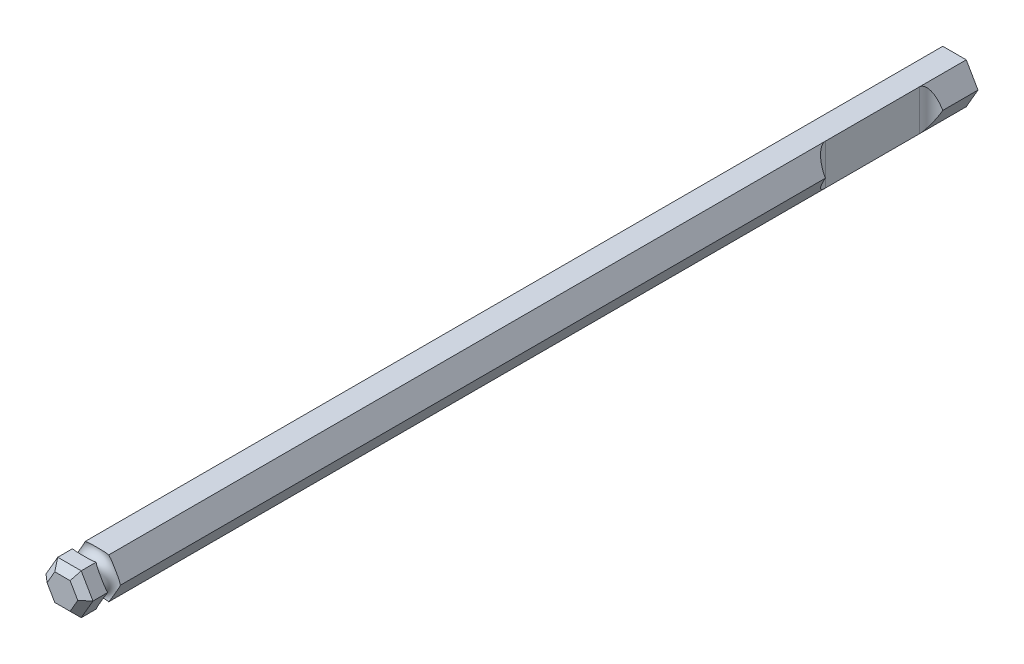
from build123d import *

# Parameters (mm, degrees)
SALIENTE_EXTRUIR1_DEPTH    = 95
CHAFL_N1_SIZE              = 0.75
CROQUIS2_R                 = 0.75
CORTAR_EXTRUIR1_DEPTH      = 96.057548464
CORTAR_EXTRUIR1_DEPTH_BACK = 96.057548464


with BuildPart() as part:
    # Croquis1 → Saliente-Extruir1 (new body)
    with BuildSketch(Plane.XY):
        Polygon((1.25, -2.165063509), (2.5, 0), (1.25, 2.165063509), (-1.25, 2.165063509), (-2.5, 0), (-1.25, -2.165063509), align=None)
    extrude(amount=-SALIENTE_EXTRUIR1_DEPTH)

    # Chaflán1
    chafl_n1_edges = [part.edges().sort_by_distance(p)[0] for p in [
        (-1.875, -1.082531755, 0),
        (-1.875, 1.082531755, 0),
        (0, 2.165063509, 0),
        (1.875, 1.082531755, 0),
        (1.875, -1.082531755, 0),
        (0, -2.165063509, 0),
    ]]
    chamfer(chafl_n1_edges, length=CHAFL_N1_SIZE)

    # Croquis2 → Cortar-Revolución1 (revolve, cut)
    with BuildSketch(Plane(origin=(0, 0, 0), x_dir=(0, 0, -1), z_dir=(1, 0, 0)), mode=Mode.PRIVATE) as cortar_revoluci_n1_sk:
        with Locations((3, 2.165063509)):
            Circle(CROQUIS2_R)
    revolve(cortar_revoluci_n1_sk.sketch.rotate(Axis((0, 0, 0), (0, 0, 1)), 329.999999874), axis=Axis((0, 0, 0), (0, 0, 1)), mode=Mode.SUBTRACT)

    # Croquis5 → Cortar-Extruir1 (cut, two sides: drawn at the far end of the back side and taken through both)
    with BuildSketch(Plane(origin=(0, 0, 0), x_dir=(1, 0, 0), z_dir=(0, 1, 0)).offset(-CORTAR_EXTRUIR1_DEPTH_BACK)):
        with BuildLine():
            Line((-1.25, 90), (-1.25, 80))
            ThreePointArc((-1.25, 80), (-2.5, 78.75), (-3.75, 80))
            Line((-3.75, 80), (-3.75, 90))
            ThreePointArc((-3.75, 90), (-2.5, 91.25), (-1.25, 90))
        make_face()
        with BuildLine():
            Line((1.25, 90), (1.25, 80))
            ThreePointArc((1.25, 80), (2.5, 78.75), (3.75, 80))
            Line((3.75, 80), (3.75, 90))
            ThreePointArc((3.75, 90), (2.5, 91.25), (1.25, 90))
        make_face()
    extrude(amount=CORTAR_EXTRUIR1_DEPTH + CORTAR_EXTRUIR1_DEPTH_BACK, mode=Mode.SUBTRACT)


solid = part.part
